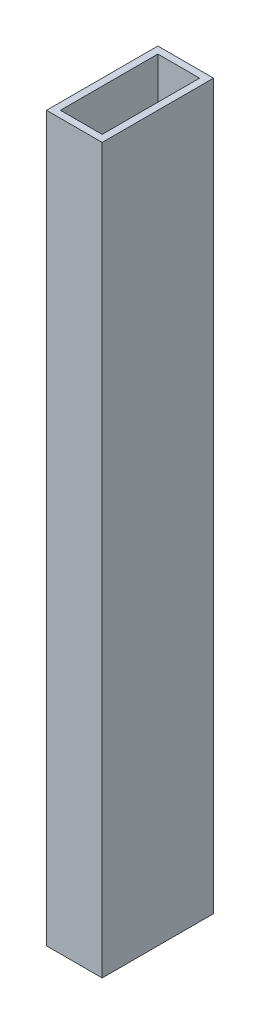
from build123d import *

# Parameters (mm, degrees)
SKETCH1_W           = 25.4
SKETCH1_H           = 50.8
SKETCH1_W_2         = 19.05
SKETCH1_H_2         = 44.45
BOSS_EXTRUDE1_DEPTH = 330.2


with BuildPart() as part:
    # Sketch1 → Boss-Extrude1 (new body)
    with BuildSketch(Plane(origin=(0, 0, 0), x_dir=(1, 0, 0), z_dir=(0, 1, 0))):
        Rectangle(SKETCH1_W, SKETCH1_H)
        Rectangle(SKETCH1_W_2, SKETCH1_H_2, mode=Mode.SUBTRACT)
    extrude(amount=BOSS_EXTRUDE1_DEPTH)


solid = part.part
